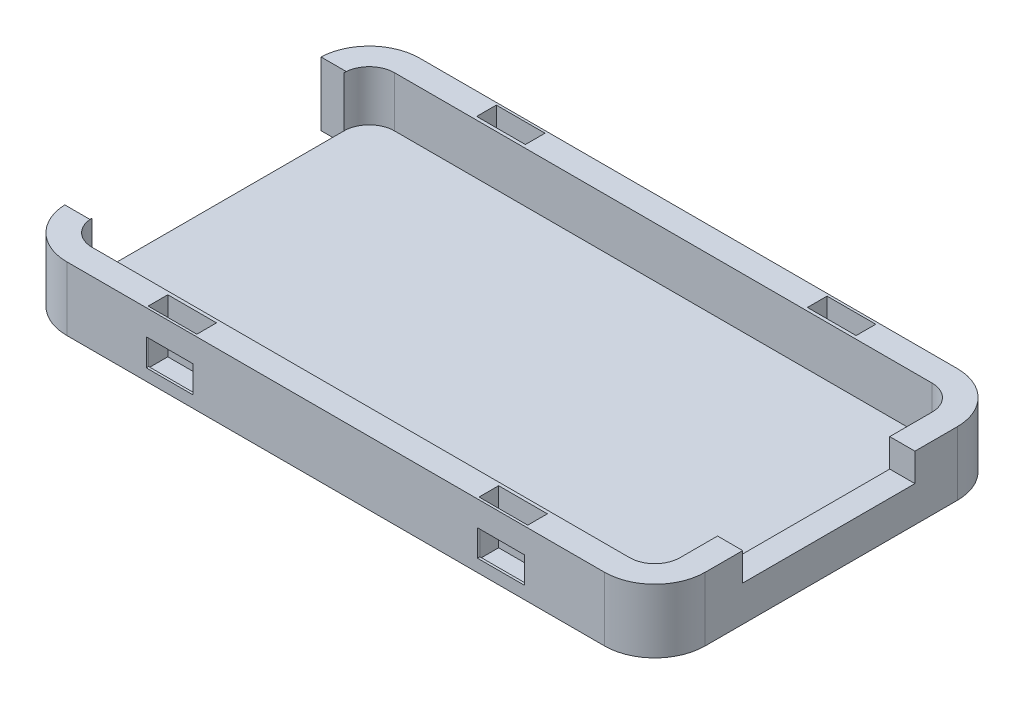
from build123d import *

# Parameters (mm, degrees)
EXTRUDE_3_DEPTH     = 3
EXTRUDE_START       = 0.8
EXTRUDE_4_DEPTH     = 0.8
SKETCH_4_W          = 3
SKETCH_4_H          = 15.25
CUT_EXTRUDE_1_DEPTH = 4
SKETCH_5_W          = 10.25
SKETCH_5_H          = 3.645381057
CUT_EXTRUDE_2_DEPTH = 3
SKETCH_6_W          = 2.899645865
SKETCH_6_H          = 1.169365381
SKETCH_6_H_2        = 1.169365382
CUT_EXTRUDE_3_DEPTH = 3.2
CUT_EXTRUDE_5_REACH = 30.478
SKETCH_7_W          = 2.785841709
SKETCH_7_H          = 1.637134251
SKETCH_7_W_2        = 2.809808384
SKETCH_7_H_2        = 1.583820861
CUT_EXTRUDE_6_REACH = 30.478
SKETCH_8_W          = 2.793582113
SKETCH_8_H          = 1.569963741
SKETCH_8_W_2        = 2.785085694
SKETCH_8_H_2        = 1.60265935


with BuildPart() as part:
    # 草图1 → 凸台-拉伸3 (new body)
    with BuildSketch(Plane(origin=(0, 0, 0), x_dir=(1, 0, 0), z_dir=(0, 1, 0))):
        with BuildLine():
            Line((-16, 10.5), (16, 10.5))
            ThreePointArc((16, 10.5), (18.121320344, 9.621320344), (19, 7.5))
            Line((19, 7.5), (19, -7.5))
            ThreePointArc((19, -7.5), (18.121320344, -9.621320344), (16, -10.5))
            Line((16, -10.5), (-16, -10.5))
            ThreePointArc((-16, -10.5), (-18.121320344, -9.621320344), (-19, -7.5))
            Line((-19, -7.5), (-19, 7.5))
            ThreePointArc((-19, 7.5), (-18.121320344, 9.621320344), (-16, 10.5))
        make_face()
        with BuildLine():
            Line((-16, 9), (16, 9))
            ThreePointArc((16, 9), (17.060660172, 8.560660172), (17.5, 7.5))
            Line((17.5, 7.5), (17.5, -7.5))
            ThreePointArc((17.5, -7.5), (17.060660172, -8.560660172), (16, -9))
            Line((16, -9), (-16, -9))
            ThreePointArc((-16, -9), (-17.060660172, -8.560660172), (-17.5, -7.5))
            Line((-17.5, -7.5), (-17.5, 7.5))
            ThreePointArc((-17.5, 7.5), (-17.060660172, 8.560660172), (-16, 9))
        make_face(mode=Mode.SUBTRACT)
    extrude(amount=EXTRUDE_3_DEPTH)

    # 草图3 → 凸台-拉伸4 (add)
    with BuildSketch(Plane.XZ.offset(EXTRUDE_START)):
        with BuildLine():
            Line((-16, 10.5), (16, 10.5))
            ThreePointArc((16, 10.5), (18.121320344, 9.621320344), (19, 7.5))
            Line((19, 7.5), (19, -7.5))
            ThreePointArc((19, -7.5), (18.121320344, -9.621320344), (16, -10.5))
            Line((16, -10.5), (-16, -10.5))
            ThreePointArc((-16, -10.5), (-18.121320344, -9.621320344), (-19, -7.5))
            Line((-19, -7.5), (-19, 7.5))
            ThreePointArc((-19, 7.5), (-18.121320344, 9.621320344), (-16, 10.5))
        make_face()
    extrude(amount=-EXTRUDE_4_DEPTH)

    # 草图4 → 切除-拉伸1 (cut)
    with BuildSketch(Plane(origin=(0, 3, 0), x_dir=(1, 0, 0), z_dir=(0, 1, 0))):
        with Locations((-19, 0)):
            Rectangle(SKETCH_4_W, SKETCH_4_H)
    extrude(amount=-CUT_EXTRUDE_1_DEPTH, mode=Mode.SUBTRACT)

    # 草图5 → 切除-拉伸2 (cut)
    with BuildSketch(Plane(origin=(19, 0, 0), x_dir=(0, 0, -1), z_dir=(1, 0, 0))):
        with Locations((-0.144, 3.148589472)):
            Rectangle(SKETCH_5_W, SKETCH_5_H)
    extrude(amount=-CUT_EXTRUDE_2_DEPTH, mode=Mode.SUBTRACT)

    # 草图6 → 切除-拉伸3 (cut)
    with BuildSketch(Plane(origin=(0, 3, 0), x_dir=(1, 0, 0), z_dir=(0, 1, 0))):
        with Locations((9.842196581, -9.77321518)):
            Rectangle(SKETCH_6_W, SKETCH_6_H)
        with Locations((-9.847989742, -9.777101279)):
            Rectangle(SKETCH_6_W, SKETCH_6_H_2)
        with Locations((9.842196581, 9.77321518)):
            Rectangle(SKETCH_6_W, SKETCH_6_H)
        with Locations((-9.847989742, 9.777101279)):
            Rectangle(SKETCH_6_W, SKETCH_6_H_2)
    extrude(amount=-CUT_EXTRUDE_3_DEPTH, mode=Mode.SUBTRACT)

    # 切除-拉伸5: up to this face of the body (flat: up to its plane)
    cut_extrude_5_end = Plane(part.part.faces().sort_by_distance((9.84219658, 1.4, -10.357897871))[0])
    # 草图7 → 切除-拉伸5 (cut, up to the picked face)
    with BuildSketch(Plane(origin=(0, 0, -10.5), x_dir=(-1, 0, 0), z_dir=(0, 0, -1)), mode=Mode.PRIVATE) as cut_extrude_5_sk1:
        with Locations((9.877407398, 0.717488498)):
            Rectangle(SKETCH_7_W, SKETCH_7_H)
    cut_extrude_5_tool1 = split(extrude(cut_extrude_5_sk1.sketch, amount=-CUT_EXTRUDE_5_REACH, mode=Mode.PRIVATE), bisect_by=cut_extrude_5_end, keep=Keep.BOTH, mode=Mode.PRIVATE)
    # 草图7 → 切除-拉伸5 (cut, up to the picked face)
    with BuildSketch(Plane(origin=(0, 0, -10.5), x_dir=(-1, 0, 0), z_dir=(0, 0, -1)), mode=Mode.PRIVATE) as cut_extrude_5_sk2:
        with Locations((-9.836726154, 0.744145193)):
            Rectangle(SKETCH_7_W_2, SKETCH_7_H_2)
    cut_extrude_5_tool2 = split(extrude(cut_extrude_5_sk2.sketch, amount=-CUT_EXTRUDE_5_REACH, mode=Mode.PRIVATE), bisect_by=cut_extrude_5_end, keep=Keep.BOTH, mode=Mode.PRIVATE)
    add(cut_extrude_5_tool1.solids().sort_by(Axis((-9.877407, 0.717488, -10.5), (0, 0, 1)))[0], mode=Mode.SUBTRACT)
    add(cut_extrude_5_tool2.solids().sort_by(Axis((9.836726, 0.744145, -10.5), (0, 0, 1)))[0], mode=Mode.SUBTRACT)

    # 草图8 → 切除-拉伸6 (cut, up to next)
    with BuildSketch(Plane.XY.offset(10.5), mode=Mode.PRIVATE) as cut_extrude_6_sk1:
        with Locations((9.840094375, 0.730022081)):
            Rectangle(SKETCH_8_W, SKETCH_8_H)
    cut_extrude_6_tool1 = extrude(cut_extrude_6_sk1.sketch, amount=-CUT_EXTRUDE_6_REACH, mode=Mode.PRIVATE) & part.part
    # 草图8 → 切除-拉伸6 (cut, up to next)
    with BuildSketch(Plane.XY.offset(10.5), mode=Mode.PRIVATE) as cut_extrude_6_sk2:
        with Locations((-9.878038676, 0.698670325)):
            Rectangle(SKETCH_8_W_2, SKETCH_8_H_2)
    cut_extrude_6_tool2 = extrude(cut_extrude_6_sk2.sketch, amount=-CUT_EXTRUDE_6_REACH, mode=Mode.PRIVATE) & part.part
    add(cut_extrude_6_tool1.solids().sort_by_distance((9.840094, 0.730022, 10.5))[0], mode=Mode.SUBTRACT)
    add(cut_extrude_6_tool2.solids().sort_by_distance((-9.878039, 0.69867, 10.5))[0], mode=Mode.SUBTRACT)


solid = part.part
